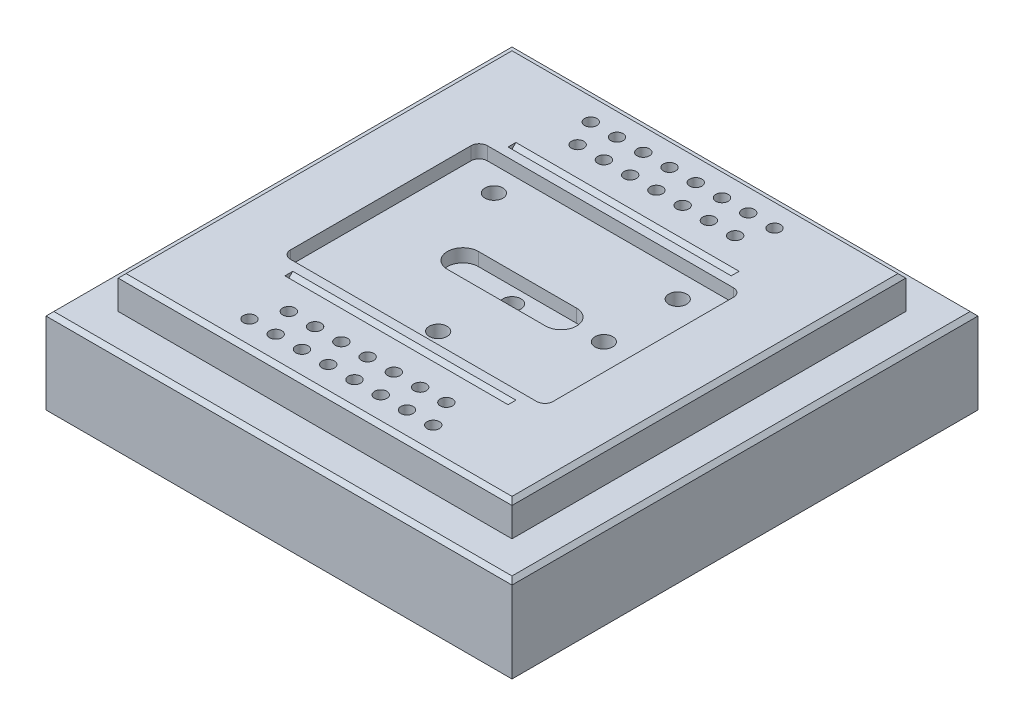
from build123d import *

# Parameters (mm, degrees)
SKETCH1_W                                 = 76.2
SKETCH1_H                                 = 76.2
BOSS_EXTRUDE1_DEPTH                       = 6.35
SKETCH13_W                                = 90.17
SKETCH13_H                                = 90.17
BOSS_EXTRUDE2_DEPTH                       = 16.51
CUT_EXTRUDE1_DEPTH                        = 2.54
F_3_32_0_09375_DIAMETER_HOLE1_AT_2_COUNT  = 2
F_3_32_0_09375_DIAMETER_HOLE1_AT_2_PITCH  = 30.48
F_3_32_0_09375_DIAMETER_HOLE1_AT_3_COUNT  = 2
F_3_32_0_09375_DIAMETER_HOLE1_AT_3_PITCH  = 5.679612663
F_3_32_0_09375_DIAMETER_HOLE1_AT_4_COUNT  = 2
F_3_32_0_09375_DIAMETER_HOLE1_AT_4_PITCH  = 33.408483952
F_3_32_0_09375_DIAMETER_HOLE1_AT_5_COUNT  = 2
F_3_32_0_09375_DIAMETER_HOLE1_AT_5_PITCH  = 5.679612663
F_3_32_0_09375_DIAMETER_HOLE1_AT_6_COUNT  = 2
F_3_32_0_09375_DIAMETER_HOLE1_AT_6_PITCH  = 9.15810024
F_3_32_0_09375_DIAMETER_HOLE1_AT_7_COUNT  = 2
F_3_32_0_09375_DIAMETER_HOLE1_AT_7_PITCH  = 13.67831861
F_3_32_0_09375_DIAMETER_HOLE1_AT_8_COUNT  = 2
F_3_32_0_09375_DIAMETER_HOLE1_AT_8_PITCH  = 18.491479119
F_3_32_0_09375_DIAMETER_HOLE1_AT_9_COUNT  = 2
F_3_32_0_09375_DIAMETER_HOLE1_AT_9_PITCH  = 23.417642922
F_3_32_0_09375_DIAMETER_HOLE1_AT_10_COUNT = 2
F_3_32_0_09375_DIAMETER_HOLE1_AT_10_PITCH = 28.398063314
F_3_32_0_09375_DIAMETER_HOLE1_AT_11_COUNT = 2
F_3_32_0_09375_DIAMETER_HOLE1_AT_11_PITCH = 5.08
F_3_32_0_09375_DIAMETER_HOLE1_AT_12_COUNT = 2
F_3_32_0_09375_DIAMETER_HOLE1_AT_12_PITCH = 10.16
F_3_32_0_09375_DIAMETER_HOLE1_AT_13_COUNT = 2
F_3_32_0_09375_DIAMETER_HOLE1_AT_13_PITCH = 15.24
F_3_32_0_09375_DIAMETER_HOLE1_AT_14_COUNT = 2
F_3_32_0_09375_DIAMETER_HOLE1_AT_14_PITCH = 20.32
F_3_32_0_09375_DIAMETER_HOLE1_AT_15_COUNT = 2
F_3_32_0_09375_DIAMETER_HOLE1_AT_15_PITCH = 25.4
CUT_EXTRUDE4_DEPTH                        = 21.59
CHAMFER1_SIZE                             = 0.762
CUT_EXTRUDE8_DEPTH                        = 13.97
SKETCH15_R                                = 4.7625
CUT_EXTRUDE9_DEPTH                        = 5.08
F_8_32_TAPPED_HOLE1_D                     = 3.4544
F_8_32_TAPPED_HOLE1_DEPTH                 = 10.7188
F_8_32_TAPPED_HOLE1_TIP                   = 1.037806461
CUT_EXTRUDE17_DEPTH                       = 2.54


with BuildPart() as part:
    # Sketch1 → Boss-Extrude1 (new body)
    with BuildSketch(Plane(origin=(0, 0, 0), x_dir=(1, 0, 0), z_dir=(0, 1, 0))):
        Rectangle(SKETCH1_W, SKETCH1_H)
    extrude(amount=BOSS_EXTRUDE1_DEPTH)

    # Sketch13 → Boss-Extrude2 (add)
    with BuildSketch(Plane.XZ):
        Rectangle(SKETCH13_W, SKETCH13_H)
    extrude(amount=BOSS_EXTRUDE2_DEPTH)

    # Sketch2 → Cut-Extrude1 (cut)
    with BuildSketch(Plane(origin=(0, 6.35, 0), x_dir=(1, 0, 0), z_dir=(0, 1, 0))):
        with BuildLine():
            Line((-23.8125, 19.05), (23.8125, 19.05))
            ThreePointArc((23.8125, 19.05), (24.935032015, 18.585032015), (25.4, 17.4625))
            Line((25.4, 17.4625), (25.4, -17.4625))
            ThreePointArc((25.4, -17.4625), (24.935032015, -18.585032015), (23.8125, -19.05))
            Line((23.8125, -19.05), (-23.8125, -19.05))
            ThreePointArc((-23.8125, -19.05), (-24.935032015, -18.585032015), (-25.4, -17.4625))
            Line((-25.4, -17.4625), (-25.4, 17.4625))
            ThreePointArc((-25.4, 17.4625), (-24.935032015, 18.585032015), (-23.8125, 19.05))
        make_face()
    extrude(amount=-CUT_EXTRUDE1_DEPTH, mode=Mode.SUBTRACT)

    # Sketch6 → 3/32 (0.09375) Diameter Hole1 (revolve, cut)
    with BuildSketch(Plane(origin=(-15.24, 6.35, -27.94), x_dir=(0, 0, 1), z_dir=(1, 0, 0))):
        Polygon((0, 0), (0, 8.335399675), (1.190625, 7.62), (1.190625, 0), align=None)
    f_3_32_0_09375_diameter_hole1 = revolve(axis=Axis((-15.24, 12.7, -27.94), (0, -1, 0)), mode=Mode.SUBTRACT)

    # 3/32 (0.09375) Diameter Hole1 at 2: 3/32 (0.09375) Diameter Hole1 ×2
    with Locations(*[(i * F_3_32_0_09375_DIAMETER_HOLE1_AT_2_PITCH, 0, 0) for i in range(1, F_3_32_0_09375_DIAMETER_HOLE1_AT_2_COUNT)]):
        add(f_3_32_0_09375_diameter_hole1, mode=Mode.SUBTRACT)

    # 3/32 (0.09375) Diameter Hole1 at 3: 3/32 (0.09375) Diameter Hole1 ×2
    with Locations(*[Vector(-0.44721359549995776, 0, -0.8944271909999161) * (i * F_3_32_0_09375_DIAMETER_HOLE1_AT_3_PITCH) for i in range(1, F_3_32_0_09375_DIAMETER_HOLE1_AT_3_COUNT)]):
        add(f_3_32_0_09375_diameter_hole1, mode=Mode.SUBTRACT)

    # 3/32 (0.09375) Diameter Hole1 at 4: 3/32 (0.09375) Diameter Hole1 ×2
    with Locations(*[Vector(0.9883716976506173, 0, -0.15205718425394119) * (i * F_3_32_0_09375_DIAMETER_HOLE1_AT_4_PITCH) for i in range(1, F_3_32_0_09375_DIAMETER_HOLE1_AT_4_COUNT)]):
        add(f_3_32_0_09375_diameter_hole1, mode=Mode.SUBTRACT)

    # 3/32 (0.09375) Diameter Hole1 at 5: 3/32 (0.09375) Diameter Hole1 ×2
    with Locations(*[Vector(0.4472135954999582, 0, -0.8944271909999159) * (i * F_3_32_0_09375_DIAMETER_HOLE1_AT_5_PITCH) for i in range(1, F_3_32_0_09375_DIAMETER_HOLE1_AT_5_COUNT)]):
        add(f_3_32_0_09375_diameter_hole1, mode=Mode.SUBTRACT)

    # 3/32 (0.09375) Diameter Hole1 at 6: 3/32 (0.09375) Diameter Hole1 ×2
    with Locations(*[Vector(0.8320502943378437, 0, -0.5547001962252293) * (i * F_3_32_0_09375_DIAMETER_HOLE1_AT_6_PITCH) for i in range(1, F_3_32_0_09375_DIAMETER_HOLE1_AT_6_COUNT)]):
        add(f_3_32_0_09375_diameter_hole1, mode=Mode.SUBTRACT)

    # 3/32 (0.09375) Diameter Hole1 at 7: 3/32 (0.09375) Diameter Hole1 ×2
    with Locations(*[Vector(0.9284766908852593, 0, -0.37139067635410383) * (i * F_3_32_0_09375_DIAMETER_HOLE1_AT_7_PITCH) for i in range(1, F_3_32_0_09375_DIAMETER_HOLE1_AT_7_COUNT)]):
        add(f_3_32_0_09375_diameter_hole1, mode=Mode.SUBTRACT)

    # 3/32 (0.09375) Diameter Hole1 at 8: 3/32 (0.09375) Diameter Hole1 ×2
    with Locations(*[Vector(0.9615239476408232, 0, -0.2747211278973781) * (i * F_3_32_0_09375_DIAMETER_HOLE1_AT_8_PITCH) for i in range(1, F_3_32_0_09375_DIAMETER_HOLE1_AT_8_COUNT)]):
        add(f_3_32_0_09375_diameter_hole1, mode=Mode.SUBTRACT)

    # 3/32 (0.09375) Diameter Hole1 at 9: 3/32 (0.09375) Diameter Hole1 ×2
    with Locations(*[Vector(0.9761870601839527, 0, -0.2169304578186562) * (i * F_3_32_0_09375_DIAMETER_HOLE1_AT_9_PITCH) for i in range(1, F_3_32_0_09375_DIAMETER_HOLE1_AT_9_COUNT)]):
        add(f_3_32_0_09375_diameter_hole1, mode=Mode.SUBTRACT)

    # 3/32 (0.09375) Diameter Hole1 at 10: 3/32 (0.09375) Diameter Hole1 ×2
    with Locations(*[Vector(0.9838699100999074, 0, -0.17888543819998323) * (i * F_3_32_0_09375_DIAMETER_HOLE1_AT_10_PITCH) for i in range(1, F_3_32_0_09375_DIAMETER_HOLE1_AT_10_COUNT)]):
        add(f_3_32_0_09375_diameter_hole1, mode=Mode.SUBTRACT)

    # 3/32 (0.09375) Diameter Hole1 at 11: 3/32 (0.09375) Diameter Hole1 ×2
    with Locations(*[(i * F_3_32_0_09375_DIAMETER_HOLE1_AT_11_PITCH, 0, 0) for i in range(1, F_3_32_0_09375_DIAMETER_HOLE1_AT_11_COUNT)]):
        add(f_3_32_0_09375_diameter_hole1, mode=Mode.SUBTRACT)

    # 3/32 (0.09375) Diameter Hole1 at 12: 3/32 (0.09375) Diameter Hole1 ×2
    with Locations(*[(i * F_3_32_0_09375_DIAMETER_HOLE1_AT_12_PITCH, 0, 0) for i in range(1, F_3_32_0_09375_DIAMETER_HOLE1_AT_12_COUNT)]):
        add(f_3_32_0_09375_diameter_hole1, mode=Mode.SUBTRACT)

    # 3/32 (0.09375) Diameter Hole1 at 13: 3/32 (0.09375) Diameter Hole1 ×2
    with Locations(*[(i * F_3_32_0_09375_DIAMETER_HOLE1_AT_13_PITCH, 0, 0) for i in range(1, F_3_32_0_09375_DIAMETER_HOLE1_AT_13_COUNT)]):
        add(f_3_32_0_09375_diameter_hole1, mode=Mode.SUBTRACT)

    # 3/32 (0.09375) Diameter Hole1 at 14: 3/32 (0.09375) Diameter Hole1 ×2
    with Locations(*[(i * F_3_32_0_09375_DIAMETER_HOLE1_AT_14_PITCH, 0, 0) for i in range(1, F_3_32_0_09375_DIAMETER_HOLE1_AT_14_COUNT)]):
        add(f_3_32_0_09375_diameter_hole1, mode=Mode.SUBTRACT)

    # 3/32 (0.09375) Diameter Hole1 at 15: 3/32 (0.09375) Diameter Hole1 ×2
    with Locations(*[(i * F_3_32_0_09375_DIAMETER_HOLE1_AT_15_PITCH, 0, 0) for i in range(1, F_3_32_0_09375_DIAMETER_HOLE1_AT_15_COUNT)]):
        add(f_3_32_0_09375_diameter_hole1, mode=Mode.SUBTRACT)

    # Mirror1: 3/32 (0.09375) Diameter Hole1 across plane
    add(f_3_32_0_09375_diameter_hole1.mirror(Plane.XY), mode=Mode.SUBTRACT)

    # Mirror1 copy 1 sketch → Mirror1 copy 1 (revolve, cut)
    with BuildSketch(Plane(origin=(15.24, 6.35, 27.94), x_dir=(0, 0, -1), z_dir=(1, 0, 0))):
        Polygon((0, 0), (0, -8.335399675), (1.190625, -7.62), (1.190625, 0), align=None)
    revolve(axis=Axis((15.24, 12.7, 27.94), (0, 1, 0)), mode=Mode.SUBTRACT)

    # Mirror1 copy 2 sketch → Mirror1 copy 2 (revolve, cut)
    with BuildSketch(Plane(origin=(-17.78, 6.35, 33.02), x_dir=(0, 0, -1), z_dir=(1, 0, 0))):
        Polygon((0, 0), (0, -8.335399675), (1.190625, -7.62), (1.190625, 0), align=None)
    revolve(axis=Axis((-17.78, 12.7, 33.02), (0, 1, 0)), mode=Mode.SUBTRACT)

    # Mirror1 copy 3 sketch → Mirror1 copy 3 (revolve, cut)
    with BuildSketch(Plane(origin=(17.78, 6.35, 33.02), x_dir=(0, 0, -1), z_dir=(1, 0, 0))):
        Polygon((0, 0), (0, -8.335399675), (1.190625, -7.62), (1.190625, 0), align=None)
    revolve(axis=Axis((17.78, 12.7, 33.02), (0, 1, 0)), mode=Mode.SUBTRACT)

    # Mirror1 copy 4 sketch → Mirror1 copy 4 (revolve, cut)
    with BuildSketch(Plane(origin=(-12.7, 6.35, 33.02), x_dir=(0, 0, -1), z_dir=(1, 0, 0))):
        Polygon((0, 0), (0, -8.335399675), (1.190625, -7.62), (1.190625, 0), align=None)
    revolve(axis=Axis((-12.7, 12.7, 33.02), (0, 1, 0)), mode=Mode.SUBTRACT)

    # Mirror1 copy 5 sketch → Mirror1 copy 5 (revolve, cut)
    with BuildSketch(Plane(origin=(-7.62, 6.35, 33.02), x_dir=(0, 0, -1), z_dir=(1, 0, 0))):
        Polygon((0, 0), (0, -8.335399675), (1.190625, -7.62), (1.190625, 0), align=None)
    revolve(axis=Axis((-7.62, 12.7, 33.02), (0, 1, 0)), mode=Mode.SUBTRACT)

    # Mirror1 copy 6 sketch → Mirror1 copy 6 (revolve, cut)
    with BuildSketch(Plane(origin=(-2.54, 6.35, 33.02), x_dir=(0, 0, -1), z_dir=(1, 0, 0))):
        Polygon((0, 0), (0, -8.335399675), (1.190625, -7.62), (1.190625, 0), align=None)
    revolve(axis=Axis((-2.54, 12.7, 33.02), (0, 1, 0)), mode=Mode.SUBTRACT)

    # Mirror1 copy 7 sketch → Mirror1 copy 7 (revolve, cut)
    with BuildSketch(Plane(origin=(2.54, 6.35, 33.02), x_dir=(0, 0, -1), z_dir=(1, 0, 0))):
        Polygon((0, 0), (0, -8.335399675), (1.190625, -7.62), (1.190625, 0), align=None)
    revolve(axis=Axis((2.54, 12.7, 33.02), (0, 1, 0)), mode=Mode.SUBTRACT)

    # Mirror1 copy 8 sketch → Mirror1 copy 8 (revolve, cut)
    with BuildSketch(Plane(origin=(7.62, 6.35, 33.02), x_dir=(0, 0, -1), z_dir=(1, 0, 0))):
        Polygon((0, 0), (0, -8.335399675), (1.190625, -7.62), (1.190625, 0), align=None)
    revolve(axis=Axis((7.62, 12.7, 33.02), (0, 1, 0)), mode=Mode.SUBTRACT)

    # Mirror1 copy 9 sketch → Mirror1 copy 9 (revolve, cut)
    with BuildSketch(Plane(origin=(12.7, 6.35, 33.02), x_dir=(0, 0, -1), z_dir=(1, 0, 0))):
        Polygon((0, 0), (0, -8.335399675), (1.190625, -7.62), (1.190625, 0), align=None)
    revolve(axis=Axis((12.7, 12.7, 33.02), (0, 1, 0)), mode=Mode.SUBTRACT)

    # Mirror1 copy 10 sketch → Mirror1 copy 10 (revolve, cut)
    with BuildSketch(Plane(origin=(-10.16, 6.35, 27.94), x_dir=(0, 0, -1), z_dir=(1, 0, 0))):
        Polygon((0, 0), (0, -8.335399675), (1.190625, -7.62), (1.190625, 0), align=None)
    revolve(axis=Axis((-10.16, 12.7, 27.94), (0, 1, 0)), mode=Mode.SUBTRACT)

    # Mirror1 copy 11 sketch → Mirror1 copy 11 (revolve, cut)
    with BuildSketch(Plane(origin=(-5.08, 6.35, 27.94), x_dir=(0, 0, -1), z_dir=(1, 0, 0))):
        Polygon((0, 0), (0, -8.335399675), (1.190625, -7.62), (1.190625, 0), align=None)
    revolve(axis=Axis((-5.08, 12.7, 27.94), (0, 1, 0)), mode=Mode.SUBTRACT)

    # Mirror1 copy 12 sketch → Mirror1 copy 12 (revolve, cut)
    with BuildSketch(Plane(origin=(0, 6.35, 27.94), x_dir=(0, 0, -1), z_dir=(1, 0, 0))):
        Polygon((0, 0), (0, -8.335399675), (1.190625, -7.62), (1.190625, 0), align=None)
    revolve(axis=Axis((0, 12.7, 27.94), (0, 1, 0)), mode=Mode.SUBTRACT)

    # Mirror1 copy 13 sketch → Mirror1 copy 13 (revolve, cut)
    with BuildSketch(Plane(origin=(5.08, 6.35, 27.94), x_dir=(0, 0, -1), z_dir=(1, 0, 0))):
        Polygon((0, 0), (0, -8.335399675), (1.190625, -7.62), (1.190625, 0), align=None)
    revolve(axis=Axis((5.08, 12.7, 27.94), (0, 1, 0)), mode=Mode.SUBTRACT)

    # Mirror1 copy 14 sketch → Mirror1 copy 14 (revolve, cut)
    with BuildSketch(Plane(origin=(10.16, 6.35, 27.94), x_dir=(0, 0, -1), z_dir=(1, 0, 0))):
        Polygon((0, 0), (0, -8.335399675), (1.190625, -7.62), (1.190625, 0), align=None)
    revolve(axis=Axis((10.16, 12.7, 27.94), (0, 1, 0)), mode=Mode.SUBTRACT)

    # Sketch8 → Cut-Extrude4 (cut, symmetric)
    with BuildSketch(Plane(origin=(0, 0, 0), x_dir=(0, 0, -1), z_dir=(1, 0, 0))):
        Polygon((20.828, 6.35), (21.59, 5.588), (22.352, 6.35), align=None)
    cut_extrude4 = extrude(amount=CUT_EXTRUDE4_DEPTH, both=True, mode=Mode.SUBTRACT)

    # Mirror2: Cut-Extrude4 across plane
    add(cut_extrude4.mirror(Plane.XY), mode=Mode.SUBTRACT)

    # Chamfer1
    chamfer1_edges = [part.edges().sort_by_distance(p)[0] for p in [
        (-38.1, 6.35, 0),
        (0, 6.35, 38.1),
        (45.085, 0, 0),
        (0, 0, 45.085),
        (-45.085, 0, 0),
        (0, 0, -45.085),
        (38.1, 6.35, 0),
        (0, 6.35, -38.1),
    ]]
    chamfer(chamfer1_edges, length=CHAMFER1_SIZE)

    # Sketch14 → Cut-Extrude8 (cut)
    with BuildSketch(Plane.XZ.offset(16.51)):
        with BuildLine():
            Line((-38.735, 34.925), (31.115, 34.925))
            ThreePointArc((31.115, 34.925), (33.36006403, 33.99506403), (34.29, 31.75))
            Line((34.29, 31.75), (34.29, -31.75))
            ThreePointArc((34.29, -31.75), (33.36006403, -33.99506403), (31.115, -34.925))
            Line((31.115, -34.925), (-38.735, -34.925))
            ThreePointArc((-38.735, -34.925), (-40.98006403, -33.99506403), (-41.91, -31.75))
            Line((-41.91, -31.75), (-41.91, -15.875))
            ThreePointArc((-41.91, -15.875), (-40.98006403, -13.62993597), (-38.735, -12.7))
            Line((-38.735, -12.7), (-25.4, -12.7))
            ThreePointArc((-25.4, -12.7), (-23.603948776, -11.956051224), (-22.86, -10.16))
            Line((-22.86, -10.16), (-22.86, 10.16))
            ThreePointArc((-22.86, 10.16), (-23.603948776, 11.956051224), (-25.4, 12.7))
            Line((-25.4, 12.7), (-38.735, 12.7))
            ThreePointArc((-38.735, 12.7), (-40.98006403, 13.62993597), (-41.91, 15.875))
            Line((-41.91, 15.875), (-41.91, 31.75))
            ThreePointArc((-41.91, 31.75), (-40.98006403, 33.99506403), (-38.735, 34.925))
        make_face()
    extrude(amount=-CUT_EXTRUDE8_DEPTH, mode=Mode.SUBTRACT)

    # Sketch15 → Cut-Extrude9 (cut)
    with BuildSketch(Plane.ZY.offset(45.085)):
        with Locations((-23.8125, -8.89)):
            Circle(SKETCH15_R)
        with Locations((23.8125, -8.89)):
            Circle(SKETCH15_R)
    extrude(amount=-CUT_EXTRUDE9_DEPTH, mode=Mode.SUBTRACT)

    # #8-32 Tapped Hole1
    with Locations(Plane(origin=(0, 3.81, 0), x_dir=(1, 0, 0), z_dir=(0, 1, 0))):
        with Locations((-17.78, 14.2875), (17.78, 14.2875), (0, -14.2875), (0, 0), (17.78, 0)):
            Hole(F_8_32_TAPPED_HOLE1_D / 2, depth=F_8_32_TAPPED_HOLE1_DEPTH)
            with Locations((0, 0, -(F_8_32_TAPPED_HOLE1_DEPTH + F_8_32_TAPPED_HOLE1_TIP / 2))):  # 118° drill point
                Cone(0, F_8_32_TAPPED_HOLE1_D / 2, F_8_32_TAPPED_HOLE1_TIP, mode=Mode.SUBTRACT)

    # Sketch23 → Cut-Extrude17 (cut)
    with BuildSketch(Plane(origin=(0, 3.81, 0), x_dir=(1, 0, 0), z_dir=(0, 1, 0))):
        with BuildLine():
            Line((-9.5, 3), (9.5, 3))
            ThreePointArc((9.5, 3), (12.5, 0), (9.5, -3))
            Line((9.5, -3), (-9.5, -3))
            ThreePointArc((-9.5, -3), (-12.5, 0), (-9.5, 3))
        make_face()
    extrude(amount=-CUT_EXTRUDE17_DEPTH, mode=Mode.SUBTRACT)


solid = part.part
